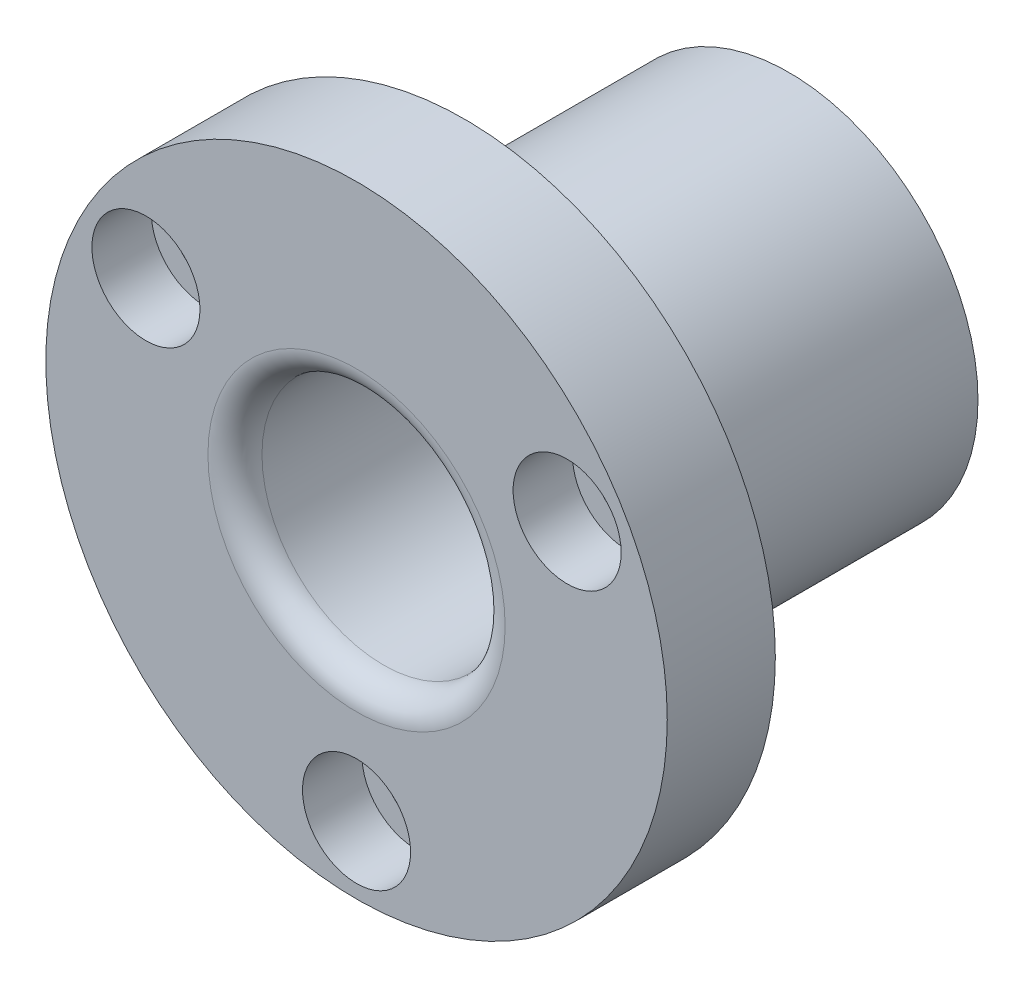
from build123d import *

# Parameters (mm, degrees)
SKETCH1_R                                           = 14
BOSS_EXTRUDE1_DEPTH                                 = 24
SKETCH2_R                                           = 23
SKETCH2_R_2                                         = 9
BOSS_EXTRUDE2_DEPTH                                 = 8
SKETCH3_R                                           = 9
CUT_EXTRUDE1_DEPTH                                  = 41.422765863
CBORE_FOR_M4_HEX_SOCKET_HEAD_CAP_SCREW1_D           = 4.5
CBORE_FOR_M4_HEX_SOCKET_HEAD_CAP_SCREW1_CBORE_D     = 8
CBORE_FOR_M4_HEX_SOCKET_HEAD_CAP_SCREW1_CBORE_DEPTH = 4.4
CIRPATTERN1_COUNT                                   = 3
FILLET1_R                                           = 2
FILLET2_R                                           = 1


with BuildPart() as part:
    # Sketch1 → Boss-Extrude1 (new body)
    with BuildSketch(Plane.XY):
        Circle(SKETCH1_R)
    extrude(amount=BOSS_EXTRUDE1_DEPTH)

    # Sketch2 → Boss-Extrude2 (add)
    with BuildSketch(Plane.XY.offset(24)):
        Circle(SKETCH2_R)
        Circle(SKETCH2_R_2, mode=Mode.SUBTRACT)
    extrude(amount=BOSS_EXTRUDE2_DEPTH)

    # Sketch3 → Cut-Extrude1 (cut, through all)
    with BuildSketch(Plane.XY.offset(24)):
        Circle(SKETCH3_R)
    extrude(amount=-CUT_EXTRUDE1_DEPTH, mode=Mode.SUBTRACT)

    # CBORE for M4 Hex Socket Head Cap Screw1 (through all)
    with Locations(Plane.XY.offset(32)):
        with Locations((0, -18)):
            cbore_for_m4_hex_socket_head_cap_screw1 = CounterBoreHole(CBORE_FOR_M4_HEX_SOCKET_HEAD_CAP_SCREW1_D / 2, CBORE_FOR_M4_HEX_SOCKET_HEAD_CAP_SCREW1_CBORE_D / 2, CBORE_FOR_M4_HEX_SOCKET_HEAD_CAP_SCREW1_CBORE_DEPTH)

    # CirPattern1: CBORE for M4 Hex Socket Head Cap Screw1 ×3 about axis
    cirpattern1_axis = Axis((0, 0, 0), (0, 0, 1))
    for i in range(1, CIRPATTERN1_COUNT):
        add(cbore_for_m4_hex_socket_head_cap_screw1.rotate(cirpattern1_axis, i * 360 / CIRPATTERN1_COUNT), mode=Mode.SUBTRACT)

    # Fillet1
    fillet1_edges = [part.edges().sort_by_distance(p)[0] for p in [
        (-9, 0, 32),
    ]]
    fillet(fillet1_edges, radius=FILLET1_R)

    # Fillet2
    fillet2_edges = [part.edges().sort_by_distance(p)[0] for p in [
        (-14, 0, 24),
    ]]
    fillet(fillet2_edges, radius=FILLET2_R)


solid = part.part
